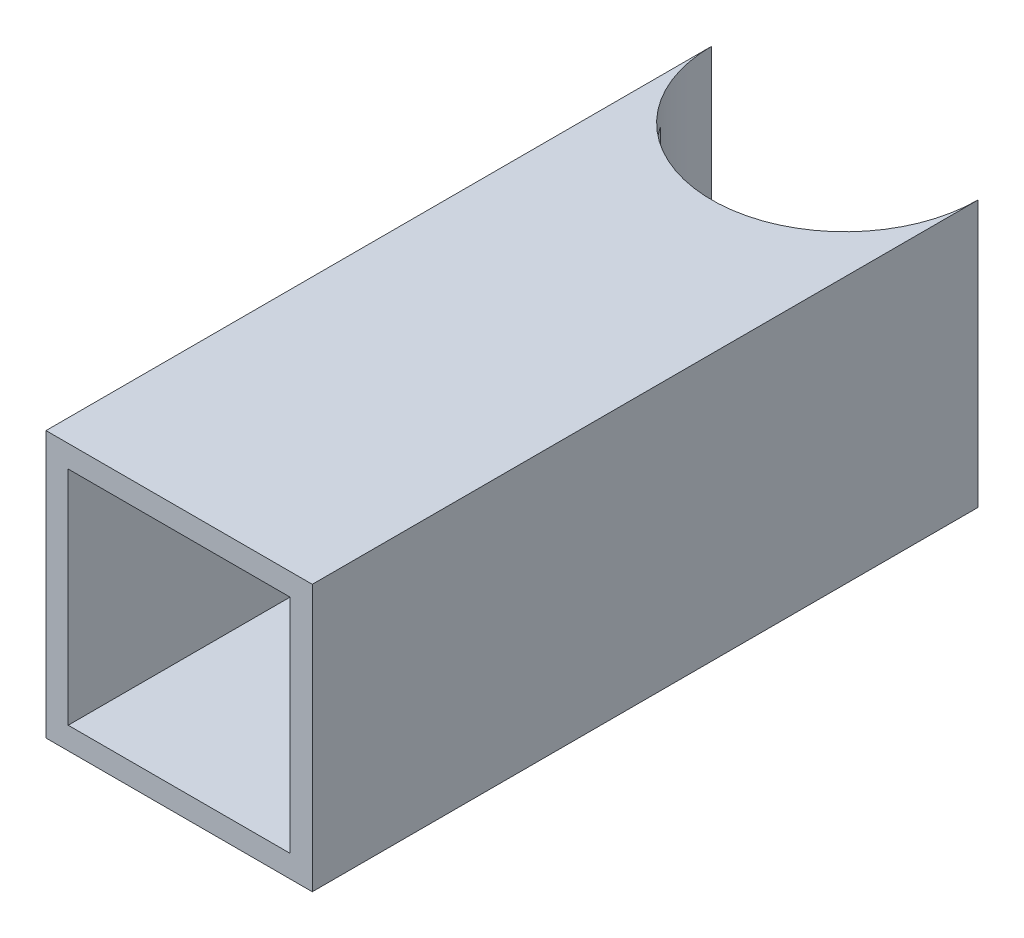
from build123d import *

# Parameters (mm, degrees)
SKETCH1_W           = 30
SKETCH1_H           = 30
SKETCH1_W_2         = 25
SKETCH1_H_2         = 25
BOSS_EXTRUDE1_DEPTH = 75
SKETCH2_R           = 15
CUT_EXTRUDE1_DEPTH  = 83.158383626


with BuildPart() as part:
    # Sketch1 → Boss-Extrude1 (new body)
    with BuildSketch(Plane.XY):
        Rectangle(SKETCH1_W, SKETCH1_H)
        Rectangle(SKETCH1_W_2, SKETCH1_H_2, mode=Mode.SUBTRACT)
    extrude(amount=BOSS_EXTRUDE1_DEPTH)

    # Sketch2 → Cut-Extrude1 (cut, through all)
    with BuildSketch(Plane.XZ.offset(15)):
        Circle(SKETCH2_R)
    extrude(amount=-CUT_EXTRUDE1_DEPTH, mode=Mode.SUBTRACT)


solid = part.part
